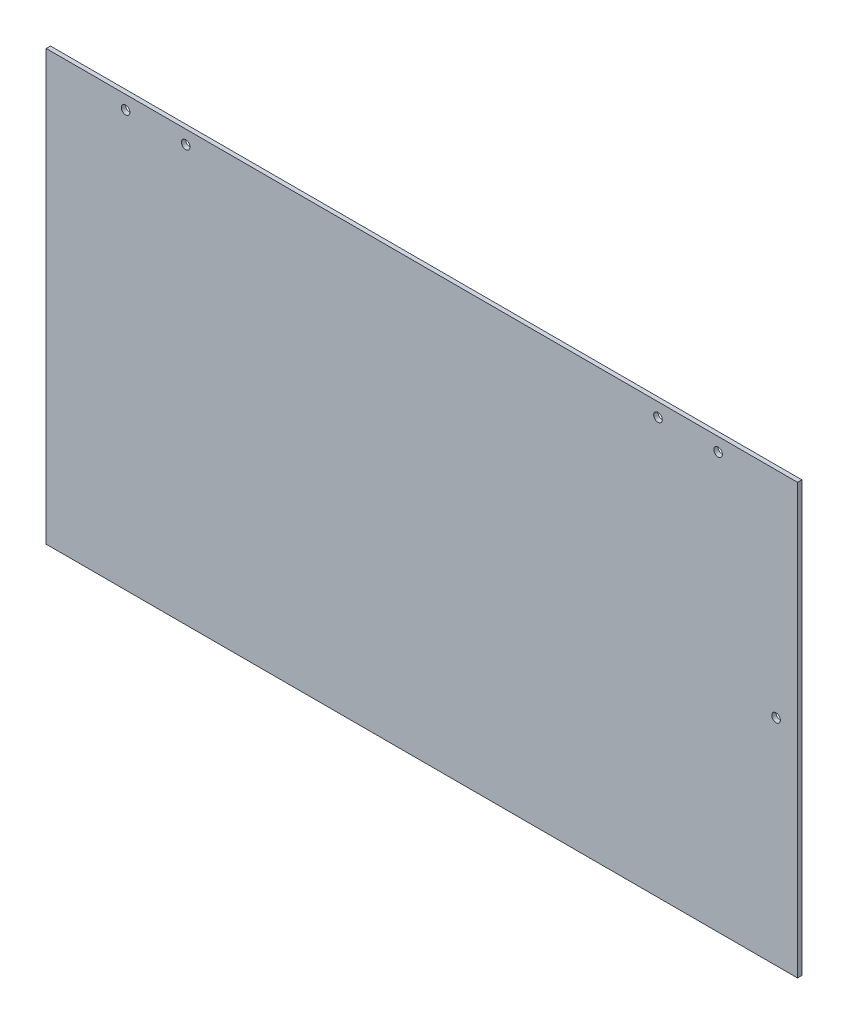
from build123d import *

# Parameters (mm, degrees)
SKETCH_1_W      = 350
SKETCH_1_H      = 200
SKETCH_1_R      = 2
EXTRUDE_1_DEPTH = 2


with BuildPart() as part:
    # 草图1 → 凸台-拉伸1 (new body)
    with BuildSketch(Plane.XY):
        with Locations((175, -100)):
            Rectangle(SKETCH_1_W, SKETCH_1_H)
        with Locations((340, -100)):
            Circle(SKETCH_1_R, mode=Mode.SUBTRACT)
        with Locations((285, -6.3)):
            Circle(SKETCH_1_R, mode=Mode.SUBTRACT)
        with Locations((313, -6.3)):
            Circle(SKETCH_1_R, mode=Mode.SUBTRACT)
        with Locations(Location((37, -6.3, 0), (0, 0, 180))):
            Circle(SKETCH_1_R, mode=Mode.SUBTRACT)
        with Locations(Location((65, -6.3, 0), (0, 0, 180))):
            Circle(SKETCH_1_R, mode=Mode.SUBTRACT)
    extrude(amount=EXTRUDE_1_DEPTH)


solid = part.part
